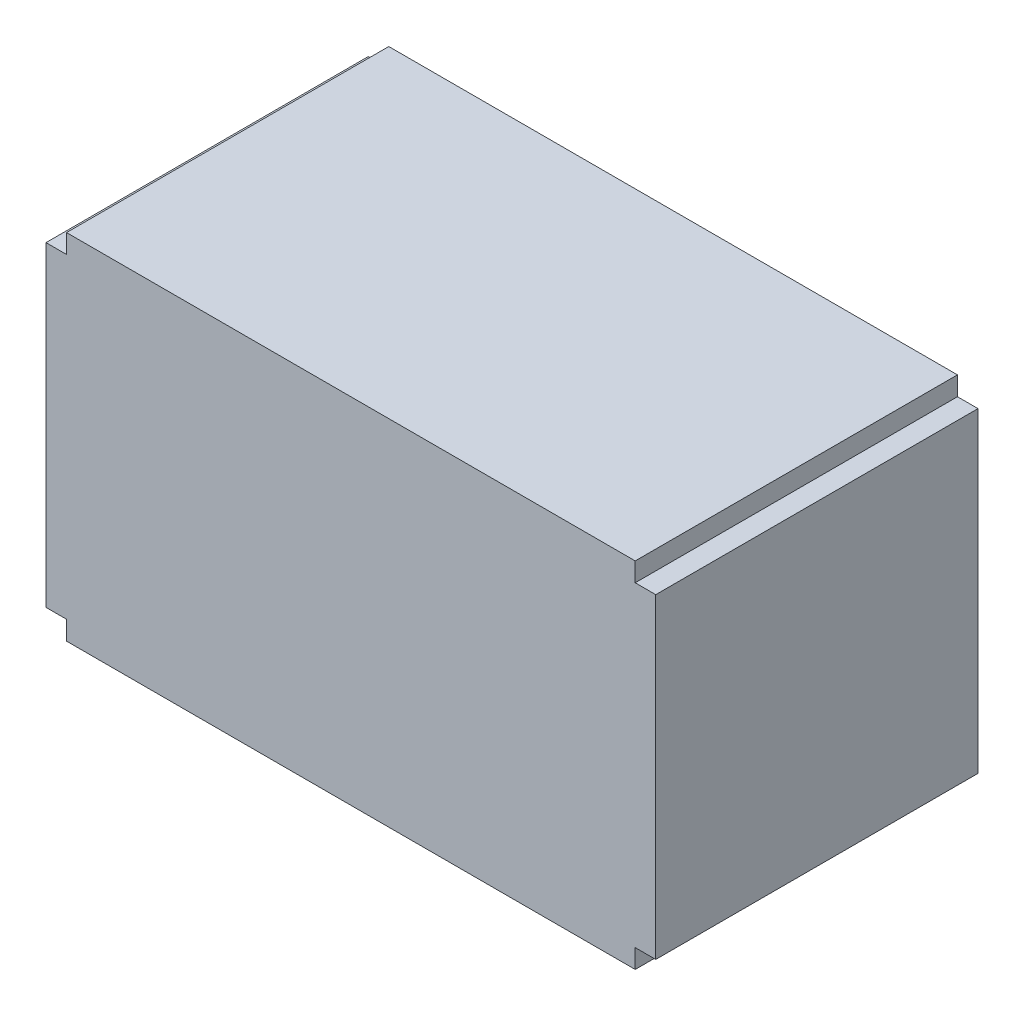
from build123d import *

# Parameters (mm, degrees)
COMPONENT_OUTLINE_DEPTH = 1.02


with BuildPart() as part:
    # 草图1 → Component_Outline (new body)
    with BuildSketch(Plane.XY):
        Polygon((0.965, -0.5), (0.9, -0.5), (0.9, -0.56), (-0.9, -0.56), (-0.9, -0.5), (-0.965, -0.5), (-0.965, 0.5), (-0.9, 0.5), (-0.9, 0.56), (0.9, 0.56), (0.9, 0.5), (0.965, 0.5), align=None)
    extrude(amount=COMPONENT_OUTLINE_DEPTH)


solid = part.part
